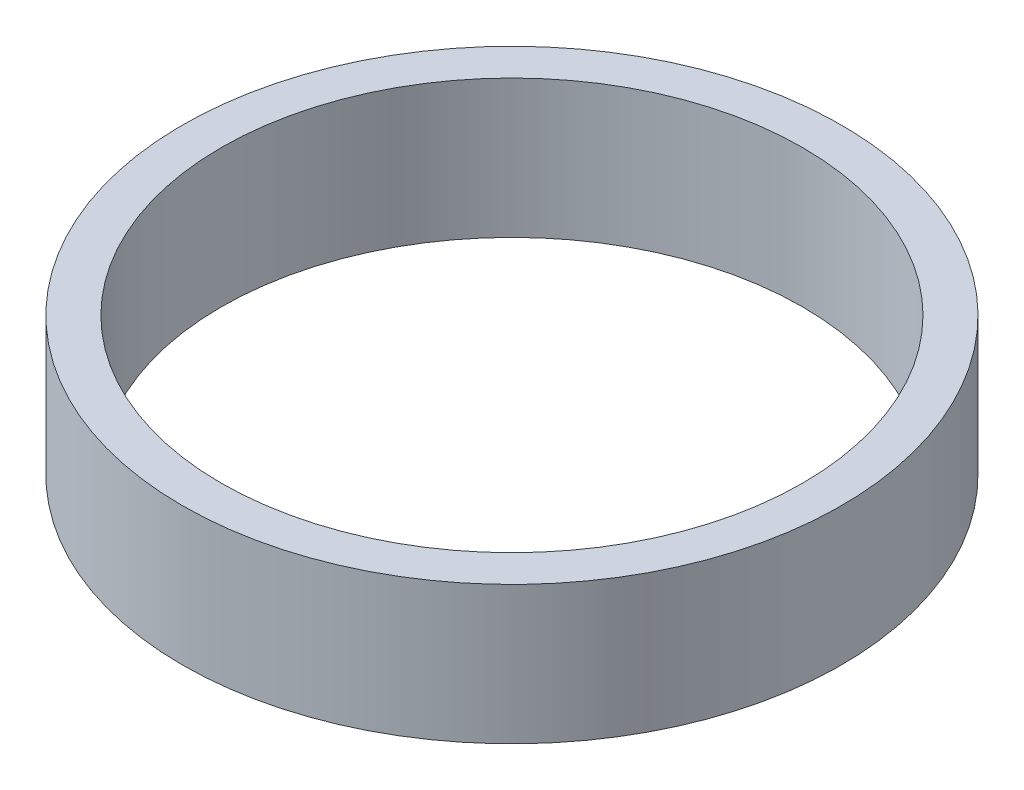
from build123d import *

# Parameters (mm, degrees)
SKETCH1_R           = 10.0076
SKETCH1_R_2         = 8.8265
BOSS_EXTRUDE1_DEPTH = 4.191


with BuildPart() as part:
    # Sketch1 → Boss-Extrude1 (new body)
    with BuildSketch(Plane(origin=(0, 0, 0), x_dir=(1, 0, 0), z_dir=(0, 1, 0))):
        with Locations(Location((0, 0, 0), (0, 0, 270))):
            Circle(SKETCH1_R)
        with Locations(Location((0, 0, 0), (0, 0, 270))):
            Circle(SKETCH1_R_2, mode=Mode.SUBTRACT)
    extrude(amount=BOSS_EXTRUDE1_DEPTH)


solid = part.part
